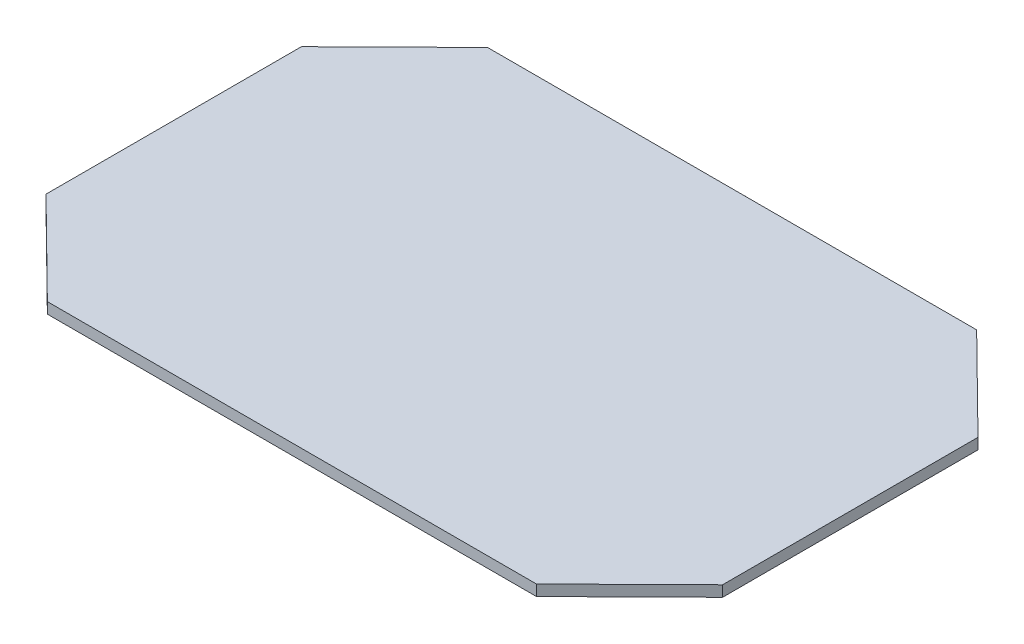
from build123d import *

# Parameters (mm, degrees)
SALIENTE_EXTRUIR1_DEPTH = 4


with BuildPart() as part:
    # Croquis1 → Saliente-Extruir1 (new body)
    with BuildSketch(Plane(origin=(0, 0, 0), x_dir=(1, 0, 0), z_dir=(0, 1, 0))):
        Polygon((-90, 81), (-124.5, 47), (-124.5, -47), (-90, -81), (0, -81), (90, -81), (124.5, -47), (124.5, 47), (90, 81), (0, 81), align=None)
    extrude(amount=SALIENTE_EXTRUIR1_DEPTH)


solid = part.part
